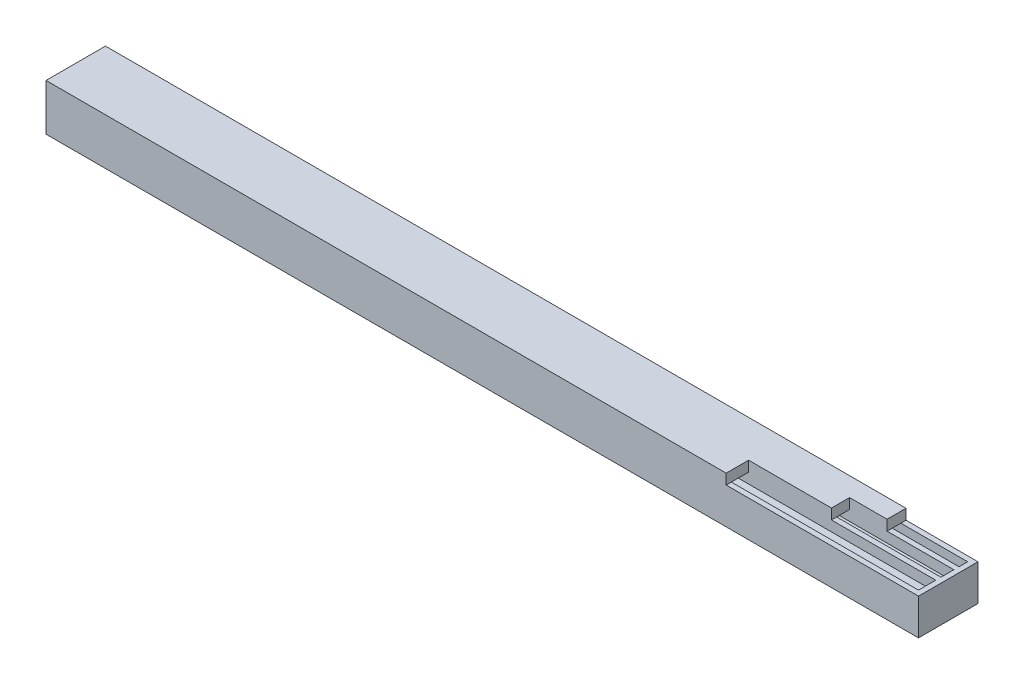
from build123d import *

# Parameters (mm, degrees)
SKETCH1_W           = 506
SKETCH1_H           = 34.5
BOSS_EXTRUDE1_DEPTH = 15
SKETCH3_W           = 506
SKETCH3_H           = 34.5
SKETCH3_W_2         = 500
SKETCH3_H_2         = 10
SKETCH3_H_3         = 5
SKETCH3_H_4         = 7.5
BOSS_EXTRUDE2_DEPTH = 6
BOSS_EXTRUDE3_DEPTH = 6


with BuildPart() as part:
    # Sketch1 → Boss-Extrude1 (new body)
    with BuildSketch(Plane(origin=(0, 0, 0), x_dir=(1, 0, 0), z_dir=(0, 1, 0))):
        with Locations((250, -9.25)):
            Rectangle(SKETCH1_W, SKETCH1_H)
    extrude(amount=-BOSS_EXTRUDE1_DEPTH)

    # Sketch3 → Boss-Extrude2 (add)
    with BuildSketch(Plane(origin=(0, 0, 0), x_dir=(1, 0, 0), z_dir=(0, 1, 0))):
        with Locations((250, -9.25)):
            Rectangle(SKETCH3_W, SKETCH3_H)
        with Locations((250, -18.5)):
            Rectangle(SKETCH3_W_2, SKETCH3_H_2, mode=Mode.SUBTRACT)
        with Locations((250, 2.5)):
            Rectangle(SKETCH3_W_2, SKETCH3_H_3, mode=Mode.SUBTRACT)
        with Locations((250, -6.75)):
            Rectangle(SKETCH3_W_2, SKETCH3_H_4, mode=Mode.SUBTRACT)
    extrude(amount=BOSS_EXTRUDE2_DEPTH)

    # Sketch4 → Boss-Extrude3 (add)
    with BuildSketch(Plane(origin=(0, 6, 0), x_dir=(1, 0, 0), z_dir=(0, 1, 0))):
        Polygon((461.264937975, 8), (461.264937975, -3), (439.515598099, -3), (439.515598099, -13.5), (391.45657289, -13.5), (391.45657289, -26.5), (-3, -26.5), (-3, 8), align=None)
    extrude(amount=BOSS_EXTRUDE3_DEPTH)


solid = part.part
